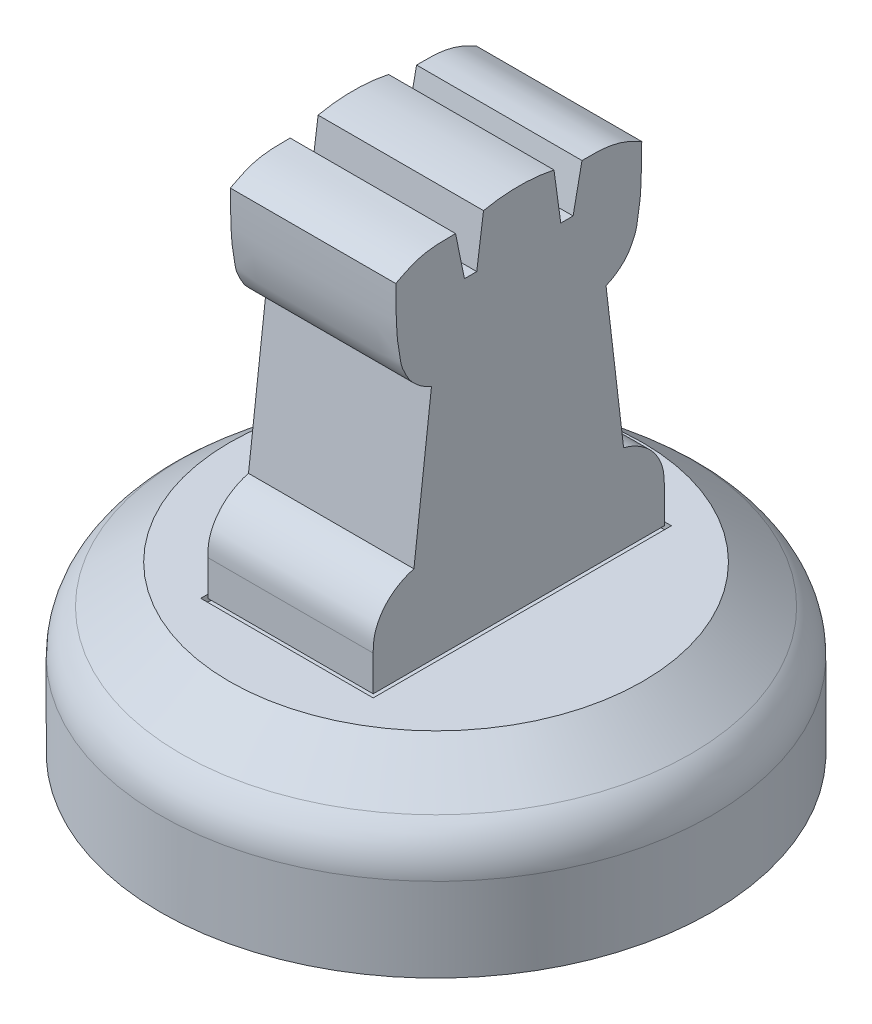
from build123d import *

# Parameters (mm, degrees)
SKETCH1_R                  = 15.875
BOSS_EXTRUDE1_DEPTH        = 6.35
FILLET1_R                  = 3.175
SKETCH3_W                  = 12.9032
SKETCH3_H                  = 19.2532
CUT_EXTRUDE1_DEPTH         = 4.7625
F_6_0_204_DIAMETER_HOLE1_D = 5.1816
BOSS_EXTRUDE2_DEPTH        = 4.7625
SKETCH7_W                  = 9.9314
SKETCH7_H                  = 17.1704
CUT_EXTRUDE2_DEPTH         = 0.396875


with BuildPart() as part:
    # Sketch1 → Boss-Extrude1 (new body)
    with BuildSketch(Plane(origin=(0, 0, 0), x_dir=(1, 0, 0), z_dir=(0, 1, 0))):
        with Locations(Location((0, 0, 0), (0, 0, 270))):
            Circle(SKETCH1_R)
    extrude(amount=BOSS_EXTRUDE1_DEPTH)

    # Sketch2 → Revolve1 (revolve)
    with BuildSketch(Plane.XY, mode=Mode.PRIVATE) as revolve1_sk:
        Polygon((-15.875, 6.35), (-11.90625, 9.525), (0, 9.525), (0, 6.35), align=None)
    revolve(revolve1_sk.sketch.rotate(Axis((0, 9.525, 0), (0, -1, 0)), 270), axis=Axis((0, 9.525, 0), (0, -1, 0)))

    # Fillet1
    fillet1_edges = [part.edges().sort_by_distance(p)[0] for p in [
        (0, 6.35, -15.875),
    ]]
    fillet(fillet1_edges, radius=FILLET1_R)

    # Sketch3 → Cut-Extrude1 (cut)
    with BuildSketch(Plane.XZ):
        Rectangle(SKETCH3_W, SKETCH3_H)
    extrude(amount=-CUT_EXTRUDE1_DEPTH, mode=Mode.SUBTRACT)

    # #6 (0.204) Diameter Hole1 (through all)
    with Locations(Plane(origin=(0, 4.7625, 0), x_dir=(-1, 0, 0), z_dir=(0, -1, 0))):
        with Locations((0, 0)):
            Hole(F_6_0_204_DIAMETER_HOLE1_D / 2)

    # Sketch7 → Cut-Extrude2 (cut)
    with BuildSketch(Plane(origin=(0, 9.525, 0), x_dir=(1, 0, 0), z_dir=(0, 1, 0))):
        Rectangle(SKETCH7_W, SKETCH7_H)
    extrude(amount=-CUT_EXTRUDE2_DEPTH, mode=Mode.SUBTRACT)


with BuildPart() as body_2:
    # Sketch6 → Boss-Extrude2 (new, symmetric)
    with BuildSketch(Plane(origin=(0, 0, 0), x_dir=(0, 0, -1), z_dir=(1, 0, 0))):
        with BuildLine():
            Line((-8.382, 9.525), (8.382, 9.525))
            Line((8.382, 9.525), (8.382, 11.557))
            add(Edge.make_bspline(
                [(8.382, 11.557), (8.382, 11.857982863), (8.344224983, 12.454053236), (7.98523621, 13.245378051), (7.486257094, 13.833251875), (6.838643181, 14.295177257), (6.349411081, 14.510920687), (6.037210454, 14.585970807)],
                knots=[0, 0, 0, 0, 0.216472078, 0.427785421, 0.616070617, 0.768549245, 1, 1, 1, 1], degree=3))
            Line((6.037210454, 14.585970807), (5.024476334, 23.180395331))
            add(Edge.make_bspline(
                [(5.024476334, 23.180395331), (5.307085674, 23.280525666), (5.76899713, 23.574819115), (6.276635868, 24.072313749), (6.547711401, 24.582995668), (6.769096893, 25.048838443), (6.865431256, 25.738772721), (7.009040885, 26.506637133), (7.066947947, 27.761736206), (7.085878737, 28.680934811), (7.082935602, 29.336149278)],
                knots=[0, 0, 0, 0, 0.128720037, 0.235851556, 0.302405084, 0.378128791, 0.457345209, 0.601695188, 0.716525225, 1, 1, 1, 1], degree=3))
            add(Edge.make_bspline(
                [(7.082935602, 29.336149278), (6.838796737, 29.455688295), (6.468231657, 29.657538579), (5.90732823, 29.882104351), (5.012922295, 30.119470051), (4.226581458, 30.108198276), (3.640384417, 30.109079786)],
                knots=[0, 0, 0, 0, 0.227779067, 0.352761532, 0.505199425, 1, 1, 1, 1], degree=3))
            Line((3.640384417, 30.109079786), (3.128109303, 27.600638464))
            Line((3.128109303, 27.600638464), (2.41829426, 27.600638464))
            Line((2.41829426, 27.600638464), (2.028639394, 30.44517579))
            ThreePointArc((2.028639394, 30.44517579), (0, 30.655626766), (-2.028639394, 30.44517579))
            Line((-2.028639394, 30.44517579), (-2.41829426, 27.600638464))
            Line((-2.41829426, 27.600638464), (-3.128109303, 27.600638464))
            Line((-3.128109303, 27.600638464), (-3.640384417, 30.109079786))
            add(Edge.make_bspline(
                [(-7.082935602, 29.336149278), (-6.838796737, 29.455688295), (-6.468231657, 29.657538579), (-5.90732823, 29.882104351), (-5.012922295, 30.119470051), (-4.226581458, 30.108198276), (-3.640384417, 30.109079786)],
                knots=[0, 0, 0, 0, 0.227779067, 0.352761532, 0.505199425, 1, 1, 1, 1], degree=3))
            add(Edge.make_bspline(
                [(-5.024476334, 23.180395331), (-5.307085674, 23.280525666), (-5.76899713, 23.574819115), (-6.276635868, 24.072313749), (-6.547711401, 24.582995668), (-6.769096893, 25.048838443), (-6.865431256, 25.738772721), (-7.009040885, 26.506637133), (-7.066947947, 27.761736206), (-7.085878737, 28.680934811), (-7.082935602, 29.336149278)],
                knots=[0, 0, 0, 0, 0.128720037, 0.235851556, 0.302405084, 0.378128791, 0.457345209, 0.601695188, 0.716525225, 1, 1, 1, 1], degree=3))
            Line((-5.024476334, 23.180395331), (-6.037210454, 14.585970807))
            add(Edge.make_bspline(
                [(-8.382, 11.557), (-8.382, 11.857982863), (-8.344224983, 12.454053236), (-7.98523621, 13.245378051), (-7.486257094, 13.833251875), (-6.838643181, 14.295177257), (-6.349411081, 14.510920687), (-6.037210454, 14.585970807)],
                knots=[0, 0, 0, 0, 0.216472078, 0.427785421, 0.616070617, 0.768549245, 1, 1, 1, 1], degree=3))
            Line((-8.382, 11.557), (-8.382, 9.525))
        make_face()
    extrude(amount=BOSS_EXTRUDE2_DEPTH, both=True)


solid = Compound([part.part, body_2.part])
